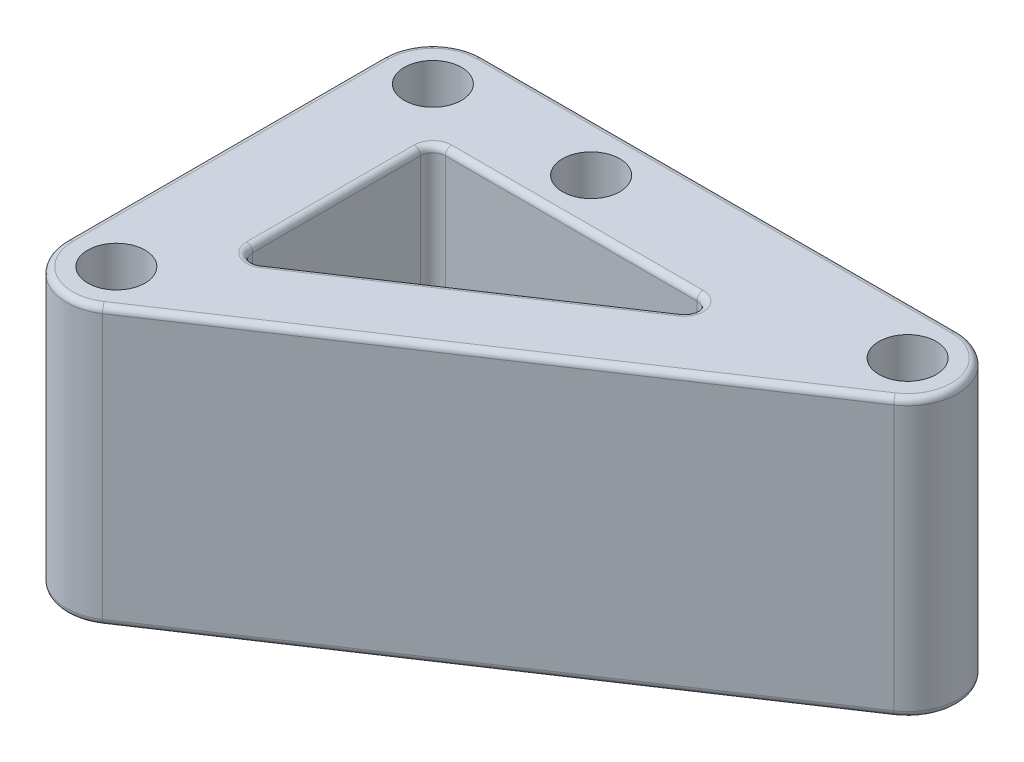
from build123d import *

# Parameters (mm, degrees)
SKETCH1_R           = 2.3
SKETCH1_R_2         = 4
BOSS_EXTRUDE1_DEPTH = 22.25
FILLET1_R           = 1
FILLET2_R           = 0.5


with BuildPart() as part:
    # Sketch1 → Boss-Extrude1 (new body)
    # profile 1 of 4: a face of its own
    with BuildSketch(Plane(origin=(0, 0, 0), x_dir=(1, 0, 0), z_dir=(0, 1, 0))):
        with BuildLine():
            ThreePointArc((4, 25.4), (0, 21.4), (-4, 25.4))
            Line((-4, 25.4), (-4, 0))
            ThreePointArc((-4, 0), (0, 4), (4, 0))
            ThreePointArc((4, 0), (3.526698395, -1.887431702), (2.218800785, -3.328201177))
            Line((2.218800785, -3.328201177), (40.318800785, 22.071798823))
            ThreePointArc((40.318800785, 22.071798823), (34.271631894, 24.240863405), (38.1, 29.4))
            Line((38.1, 29.4), (0, 29.4))
            ThreePointArc((0, 29.4), (2.828427125, 28.228427125), (4, 25.4))
        make_face()
        Polygon((4, 5.070367517), (4, 21.4), (28.494448725, 21.4), align=None, mode=Mode.SUBTRACT)
        with Locations(Location((12.7, 25.4, 0), (0, 0, 270))):
            Circle(SKETCH1_R, mode=Mode.SUBTRACT)
    # profile 2 of 4: a face of its own
    with BuildSketch(Plane(origin=(0, 0, 0), x_dir=(1, 0, 0), z_dir=(0, 1, 0))):
        Circle(SKETCH1_R_2)
        with Locations(Location((0, 0, 0), (0, 0, 270))):
            Circle(SKETCH1_R, mode=Mode.SUBTRACT)
    # profile 3 of 4: a face of its own
    with BuildSketch(Plane(origin=(0, 0, 0), x_dir=(1, 0, 0), z_dir=(0, 1, 0))):
        with Locations((38.1, 25.4)):
            Circle(SKETCH1_R_2)
        with Locations(Location((38.1, 25.4, 0), (0, 0, 270))):
            Circle(SKETCH1_R, mode=Mode.SUBTRACT)
    # profile 4 of 4: a face of its own
    with BuildSketch(Plane(origin=(0, 0, 0), x_dir=(1, 0, 0), z_dir=(0, 1, 0))):
        with Locations((0, 25.4)):
            Circle(SKETCH1_R_2)
        with Locations(Location((0, 25.4, 0), (0, 0, 270))):
            Circle(SKETCH1_R, mode=Mode.SUBTRACT)
    extrude(amount=BOSS_EXTRUDE1_DEPTH)

    # Fillet1
    fillet1_edges = [part.edges().sort_by_distance(p)[0] for p in [
        (4, 11.125, -21.4),
        (4, 11.125, -5.070367517),
        (28.494448725, 11.125, -21.4),
    ]]
    fillet(fillet1_edges, radius=FILLET1_R)

    # Fillet2
    fillet2_edges = [part.edges().sort_by_distance(p)[0] for p in [
        (19.05, 22.25, -29.4),
        (-2.828427125, 22.25, -28.228427125),
        (41.928368106, 0, -26.559136595),
        (21.268800785, 0, -9.371798823),
        (-4, 22.25, -12.7),
        (-1.887431702, 0, 3.526698395),
        (-4, 0, -12.7),
        (-2.828427125, 0, -28.228427125),
        (19.05, 0, -29.4),
        (-1.887431702, 22.25, 3.526698395),
        (21.268800785, 22.25, -9.371798823),
        (41.928368106, 22.25, -26.559136595),
        (15.65053674, 0, -12.83739201),
        (15.65053674, 22.25, -12.83739201),
        (15.095836543, 0, -21.4),
        (15.095836543, 22.25, -21.4),
        (4, 0, -13.669442304),
        (4, 22.25, -13.669442304),
        (26.148765113, 0, -20.689784149),
        (26.148765113, 22.25, -20.689784149),
        (4.528142074, 0, -6.05721001),
        (4.528142074, 22.25, -6.05721001),
        (4.292893219, 0, -21.107106781),
        (4.292893219, 22.25, -21.107106781),
    ]]
    fillet(fillet2_edges, radius=FILLET2_R)


solid = part.part
